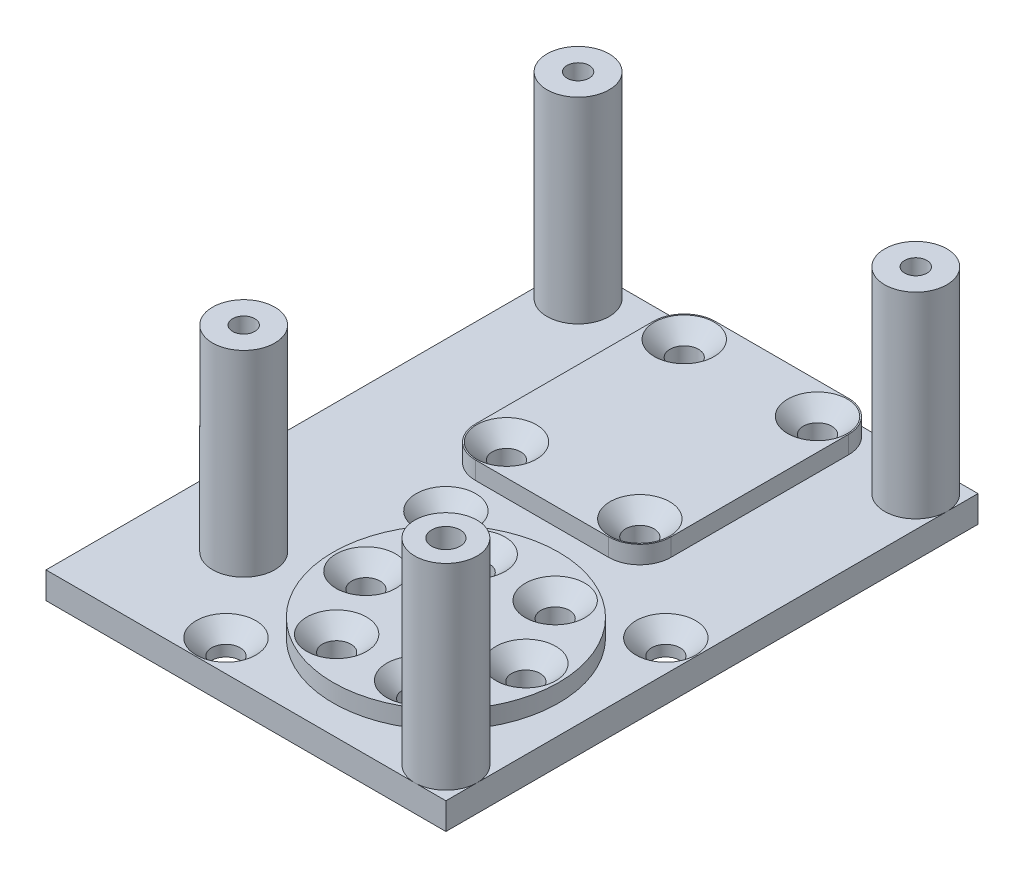
from build123d import *
from build123d.topology import SkipClean

# Parameters (mm, degrees)
SKETCH2_W                           = 45
SKETCH2_H                           = 59.874368671
MAIN_EXTRUDE_DEPTH                  = 3
BOWDEN_HOLE_D                       = 4
SKETCH7_R                           = 3.5
SPACER_PILLARS_DEPTH                = 22.1
TOP_THREADS_D                       = 2.5
TOP_THREADS_DEPTH                   = 10
TOP_THREADS_TIP                     = 0.751075774
TOP_THROUGH_HOLE_D                  = 3.2
SKETCH28_R                          = 12.7
SKETCH28_R_2                        = 2
BOSS_EXTRUDE3_DEPTH                 = 2
CHUBE_MOUNTING_D                    = 3.2
CHUBE_MOUNTING_CSINK_D              = 6.72
CHUBE_MOUNTING_CSINK_ANGLE          = 90
BOSS_EXTRUDE4_DEPTH                 = 2
CARRIAGE_HOLES_D                    = 3.2
CARRIAGE_HOLES_DEPTH                = 8
CARRIAGE_HOLES_CSINK_D              = 6.72
CARRIAGE_HOLES_CSINK_ANGLE          = 90
CARRIAGE_HOLES_TIP                  = 0.96137699
BEACON_SLM_SUPPORT_HOLES_AT_2_COUNT = 2
BEACON_SLM_SUPPORT_HOLES_AT_2_PITCH = 24.748737342
BEACON_SLM_SUPPORT_HOLES_AT_3_COUNT = 2
BEACON_SLM_SUPPORT_HOLES_AT_3_PITCH = 24.748737342


with BuildPart() as part:
    # Sketch2 → Main Extrude (new body)
    with BuildSketch(Plane(origin=(0, 0, 0), x_dir=(1, 0, 0), z_dir=(0, 1, 0))):
        with Locations((-6.625631329, 14.062815665)):
            Rectangle(SKETCH2_W, SKETCH2_H)
    extrude(amount=MAIN_EXTRUDE_DEPTH)

    # Bowden Hole (through all)
    with Locations(Plane(origin=(0, 3, 0), x_dir=(1, 0, 0), z_dir=(0, 1, 0))):
        with Locations((0, 0)):
            Hole(BOWDEN_HOLE_D / 2)

    # Sketch7 → Spacer Pillars (add)
    with BuildSketch(Plane(origin=(0, 3, 0), x_dir=(1, 0, 0), z_dir=(0, 1, 0))):
        with Locations(Location((-25.625631329, 40.5, 0), (0, 0, 90))):
            Circle(SKETCH7_R)
        with Locations(Location((12.374368671, 40.5, 0), (0, 0, 90))):
            Circle(SKETCH7_R)
        with Locations(Location((-19.761284896, -2.993325275, 0), (0, 0, 90))):
            Circle(SKETCH7_R)
        with Locations(Location((12.374368671, -12.374368671, 0), (0, 0, 270))):
            Circle(SKETCH7_R)
    extrude(amount=SPACER_PILLARS_DEPTH)

    # Top Threads
    with Locations(Plane(origin=(0, 25.1, 0), x_dir=(1, 0, 0), z_dir=(0, 1, 0))):
        with Locations((12.374368671, 40.5), (-19.761284896, -2.993325275), (-25.625631329, 40.5)):
            Hole(TOP_THREADS_D / 2, depth=TOP_THREADS_DEPTH)
            with Locations((0, 0, -(TOP_THREADS_DEPTH + TOP_THREADS_TIP / 2))):  # 118° drill point
                Cone(0, TOP_THREADS_D / 2, TOP_THREADS_TIP, mode=Mode.SUBTRACT)

    # Top Through Hole (through all)
    with Locations(Plane(origin=(0, 25.1, 0), x_dir=(1, 0, 0), z_dir=(0, 1, 0))):
        with Locations((12.374368671, -12.374368671)):
            Hole(TOP_THROUGH_HOLE_D / 2)

    # Sketch28 → Boss-Extrude3 (add)
    with SkipClean():  # the faces are left unmerged after this step: merging them gives an invalid solid
        with BuildSketch(Plane(origin=(0, 3, 0), x_dir=(1, 0, 0), z_dir=(0, 1, 0))):
            with Locations(Location((0, 0, 0), (0, 0, 90))):
                Circle(SKETCH28_R)
            with Locations(Location((0, 0, 0), (0, 0, 270))):
                Circle(SKETCH28_R_2, mode=Mode.SUBTRACT)
        extrude(amount=BOSS_EXTRUDE3_DEPTH)

    # Chube Mounting (through all)
    with Locations(Plane(origin=(0, 5, 0), x_dir=(1, 0, 0), z_dir=(0, 1, 0))):
        with Locations((-4.5, 7.794228634), (4.5, 7.794228634), (9, 0), (4.5, -7.794228634), (-4.5, -7.794228634), (-9, 0)):
            CounterSinkHole(CHUBE_MOUNTING_D / 2, CHUBE_MOUNTING_CSINK_D / 2, counter_sink_angle=CHUBE_MOUNTING_CSINK_ANGLE)

    # Sketch29 → Boss-Extrude4 (add)
    with SkipClean():  # the faces are left unmerged after this step: merging them gives an invalid solid
        with BuildSketch(Plane(origin=(0, 3, 0), x_dir=(1, 0, 0), z_dir=(0, 1, 0))):
            with BuildLine():
                Line((-17.181637577, 40.5), (-17.181637577, 20.5))
                ThreePointArc((-17.181637577, 20.5), (-16.156511311, 18.025126266), (-13.681637577, 17))
                Line((-13.681637577, 17), (1.318362423, 17))
                ThreePointArc((1.318362423, 17), (3.793236157, 18.025126266), (4.818362423, 20.5))
                Line((4.818362423, 20.5), (4.818362423, 40.5))
                ThreePointArc((4.818362423, 40.5), (3.793236157, 42.974873734), (1.318362423, 44))
                Line((1.318362423, 44), (-13.681637577, 44))
                ThreePointArc((-13.681637577, 44), (-16.156511311, 42.974873734), (-17.181637577, 40.5))
            make_face()
        extrude(amount=BOSS_EXTRUDE4_DEPTH)

    # Carriage Holes
    with Locations(Plane(origin=(0, 5, 0), x_dir=(1, 0, 0), z_dir=(0, 1, 0))):
        with Locations((1.318362423, 40.5), (1.318362423, 20.5), (-13.681637577, 20.5), (-13.681637577, 40.5)):
            CounterSinkHole(CARRIAGE_HOLES_D / 2, CARRIAGE_HOLES_CSINK_D / 2, depth=CARRIAGE_HOLES_DEPTH, counter_sink_angle=CARRIAGE_HOLES_CSINK_ANGLE)
            with Locations((0, 0, -(CARRIAGE_HOLES_DEPTH + CARRIAGE_HOLES_TIP / 2))):  # 118° drill point
                Cone(0, CARRIAGE_HOLES_D / 2, CARRIAGE_HOLES_TIP, mode=Mode.SUBTRACT)

    # Sketch25 → Beacon SLM Support Holes (revolve, cut)
    with SkipClean():  # the faces are left unmerged after this step: merging them gives an invalid solid
        with BuildSketch(Plane(origin=(-12.374368671, 3, -12.374368671), x_dir=(0, 0, 1), z_dir=(1, 0, 0))):
            Polygon((0, 0), (0, 3), (1.6, 3), (1.6, 1.76), (3.36, 0), align=None)
        beacon_slm_support_holes = revolve(axis=Axis((-12.374368671, 9.35, -12.374368671), (0, -1, 0)), mode=Mode.SUBTRACT)

    # Beacon SLM Support Holes at 2: Beacon SLM Support Holes ×2
    with SkipClean():  # the faces are left unmerged after this step: merging them gives an invalid solid
        with Locations(*[(i * BEACON_SLM_SUPPORT_HOLES_AT_2_PITCH, 0, 0) for i in range(1, BEACON_SLM_SUPPORT_HOLES_AT_2_COUNT)]):
            add(beacon_slm_support_holes, mode=Mode.SUBTRACT)

    # Beacon SLM Support Holes at 3: Beacon SLM Support Holes ×2
    with SkipClean():  # the faces are left unmerged after this step: merging them gives an invalid solid
        with Locations(*[(0, 0, i * BEACON_SLM_SUPPORT_HOLES_AT_3_PITCH) for i in range(1, BEACON_SLM_SUPPORT_HOLES_AT_3_COUNT)]):
            add(beacon_slm_support_holes, mode=Mode.SUBTRACT)


solid = part.part
